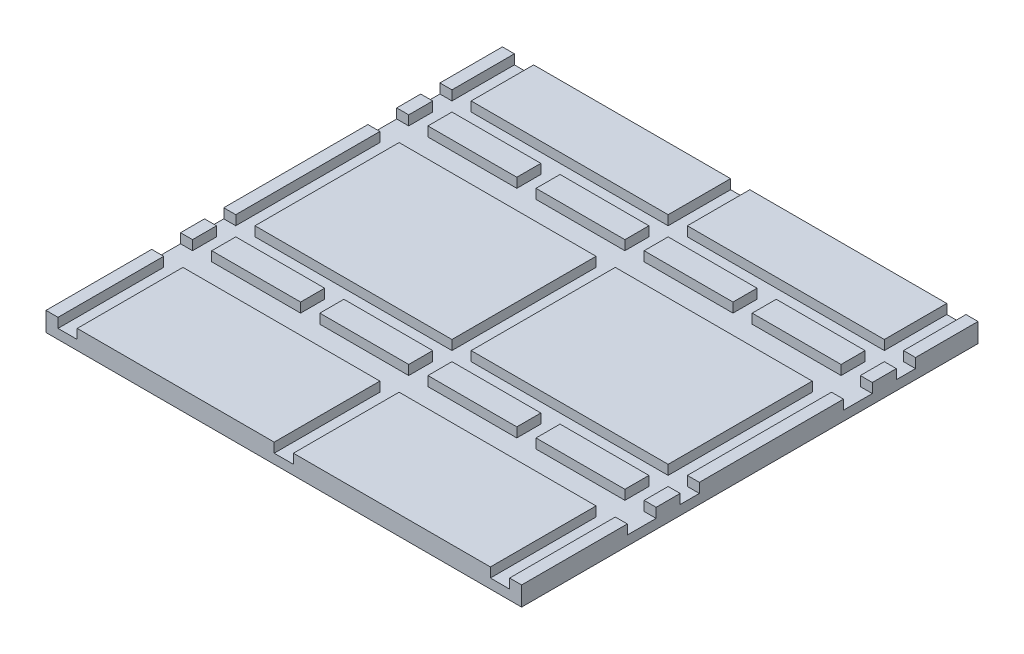
from build123d import *

# Parameters (mm, degrees)
SKETCH2_W           = 120.65
SKETCH2_H           = 120.65
BOSS_EXTRUDE1_DEPTH = 2.54
SKETCH3_W           = 52.07
SKETCH3_H           = 16.51
SKETCH3_W_2         = 0.635
SKETCH3_H_2         = 6.35
SKETCH3_H_3         = 27.94
SKETCH3_W_3         = 23.495
SKETCH3_H_4         = 38.1
BOSS_EXTRUDE2_DEPTH = 2.54
BOSS_EXTRUDE4_DEPTH = 2.54


with BuildPart() as part:
    # Sketch2 → Boss-Extrude1 (new body)
    with BuildSketch(Plane(origin=(0, 0, 0), x_dir=(1, 0, 0), z_dir=(0, 1, 0))):
        Rectangle(SKETCH2_W, SKETCH2_H)
    extrude(amount=BOSS_EXTRUDE1_DEPTH)

    # Sketch3 → Boss-Extrude2 (add)
    with BuildSketch(Plane(origin=(0, 2.54, 0), x_dir=(1, 0, 0), z_dir=(0, 1, 0))):
        with Locations((-28.575, 52.07)):
            Rectangle(SKETCH3_W, SKETCH3_H)
        with Locations((-60.0075, -21.59)):
            Rectangle(SKETCH3_W_2, SKETCH3_H_2)
        with Locations((60.0075, -46.355)):
            Rectangle(SKETCH3_W_2, SKETCH3_H_3)
        with Locations((-42.8625, -21.59)):
            Rectangle(SKETCH3_W_3, SKETCH3_H_2)
        with Locations((-14.2875, -21.59)):
            Rectangle(SKETCH3_W_3, SKETCH3_H_2)
        with Locations((-60.0075, 52.07)):
            Rectangle(SKETCH3_W_2, SKETCH3_H)
        with Locations((60.0075, 5.715)):
            Rectangle(SKETCH3_W_2, SKETCH3_H_4)
        with Locations((42.8625, -21.59)):
            Rectangle(SKETCH3_W_3, SKETCH3_H_2)
        with Locations((14.2875, -21.59)):
            Rectangle(SKETCH3_W_3, SKETCH3_H_2)
        with Locations((-60.0075, 5.715)):
            Rectangle(SKETCH3_W_2, SKETCH3_H_4)
        with Locations((-60.0075, -46.355)):
            Rectangle(SKETCH3_W_2, SKETCH3_H_3)
        with Locations((60.0075, 52.07)):
            Rectangle(SKETCH3_W_2, SKETCH3_H)
        with Locations((28.575, 52.07)):
            Rectangle(SKETCH3_W, SKETCH3_H)
        with Locations((-28.575, -46.355)):
            Rectangle(SKETCH3_W, SKETCH3_H_3)
        with Locations((28.575, -46.355)):
            Rectangle(SKETCH3_W, SKETCH3_H_3)
        with Locations((60.0075, -21.59)):
            Rectangle(SKETCH3_W_2, SKETCH3_H_2)
        with Locations((28.575, 5.715)):
            Rectangle(SKETCH3_W, SKETCH3_H_4)
        with Locations((-42.8625, 35.56)):
            Rectangle(SKETCH3_W_3, SKETCH3_H_2)
        with Locations((-14.2875, 35.56)):
            Rectangle(SKETCH3_W_3, SKETCH3_H_2)
        with Locations((14.2875, 35.56)):
            Rectangle(SKETCH3_W_3, SKETCH3_H_2)
        with Locations((42.8625, 35.56)):
            Rectangle(SKETCH3_W_3, SKETCH3_H_2)
        with Locations((-28.575, 5.715)):
            Rectangle(SKETCH3_W, SKETCH3_H_4)
        with Locations((-60.0075, 35.56)):
            Rectangle(SKETCH3_W_2, SKETCH3_H_2)
        with Locations((60.0075, 35.56)):
            Rectangle(SKETCH3_W_2, SKETCH3_H_2)
    extrude(amount=BOSS_EXTRUDE2_DEPTH)

    # Sketch5 → Boss-Extrude4 (add)
    with BuildSketch(Plane(origin=(60.325, 0, 0), x_dir=(0, 0, -1), z_dir=(1, 0, 0))):
        Polygon((-60.325, 0), (60.325, 0), (60.325, 5.08), (43.815, 5.08), (43.815, 2.54), (38.735, 2.54), (38.735, 5.08), (32.385, 5.08), (32.385, 2.54), (24.765, 2.54), (24.765, 5.08), (-13.335, 5.08), (-13.335, 2.54), (-18.415, 2.54), (-18.415, 5.08), (-24.765, 5.08), (-24.765, 2.54), (-32.385, 2.54), (-32.385, 5.08), (-60.325, 5.08), align=None)
    boss_extrude4 = extrude(amount=BOSS_EXTRUDE4_DEPTH)

    # Mirror2: Boss-Extrude4 across plane
    add(boss_extrude4.mirror(Plane(origin=(0, 0, 0), x_dir=(0, 0, 1), z_dir=(1, 0, 0))))


solid = part.part
